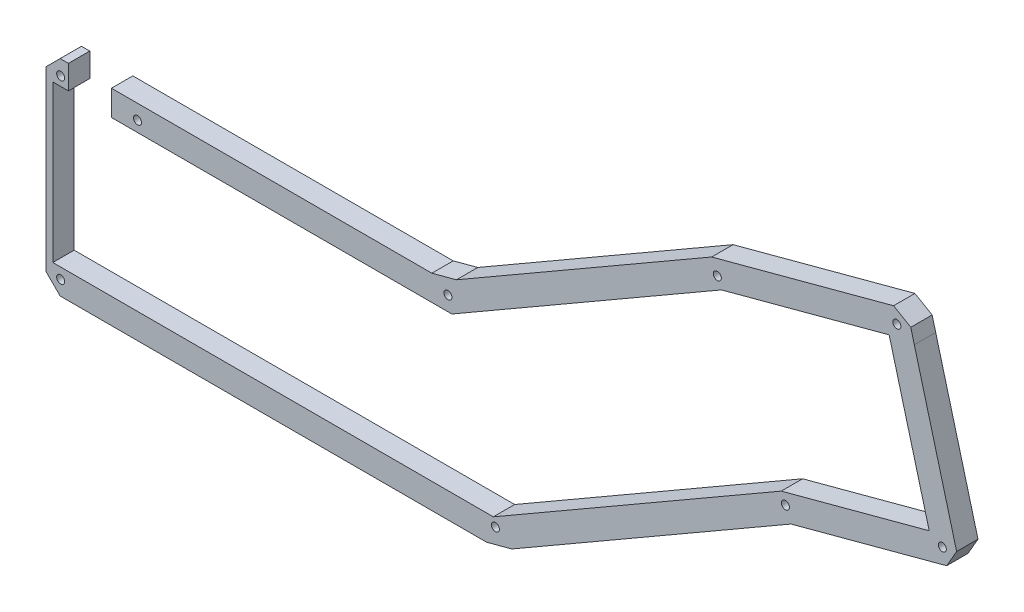
from build123d import *

# Parameters (mm, degrees)
ESQUISSE1_R        = 1.5
BOSS_EXTRU_1_DEPTH = 8


with BuildPart() as part:
    # Esquisse1 → Boss.-Extru.1 (new body)
    with BuildSketch(Plane.XY):
        Polygon((43.238760989, 49.585106383), (-75.988646329, 49.585106383), (-76.753762562, 49.585106383), (-76.753762562, 40.085106383), (2.011353671, 40.085106383), (50.71612997, 40.085106383), (151.689760112, 98.382258927), (214.4831558, 115.207698591), (229.494660416, 59.184000666), (174.076924484, 44.334863077), (66.257183131, -17.914893617), (-98.698564415, -17.914893617), (-98.698564415, 40.655573641), (-94.860830925, 40.655573641), (-92.861789188, 40.655573641), (-92.861789188, 49.585106383), (-94.860830925, 49.585106383), (-95.960869343, 49.585106383), (-101.253762562, 44.292213164), (-101.253762562, 35.79522772), (-101.253762562, -22.122000398), (-95.960869343, -27.414893617), (63.734552111, -27.414893617), (73.191845678, -24.880819443), (177.743787613, 35.482272378), (236.017194438, 51.096584676), (239.759835125, 57.579028501), (228.577013006, 99.31388882), (223.918643626, 116.699160027), (222.600104344, 121.736116557), (216.144691957, 125.488029577), (211.058449045, 124.125174896), (148.022896982, 107.234849626), (52.44172146, 52.051032209), align=None)
        with Locations((-95.753762562, -21.914893617)):
            Circle(ESQUISSE1_R, mode=Mode.SUBTRACT)
        with Locations((67.039694146, -20.835264486)):
            Circle(ESQUISSE1_R, mode=Mode.SUBTRACT)
        with Locations((-95.753762562, 44.085106383)):
            Circle(ESQUISSE1_R, mode=Mode.SUBTRACT)
        with Locations((-66.988646329, 44.085106383)):
            Circle(ESQUISSE1_R, mode=Mode.SUBTRACT)
        with Locations((49.263745973, 45.505477252)):
            Circle(ESQUISSE1_R, mode=Mode.SUBTRACT)
        with Locations((175.637377655, 40.567595866)):
            Circle(ESQUISSE1_R, mode=Mode.SUBTRACT)
        with Locations((234.393639901, 56.355573542)):
            Circle(ESQUISSE1_R, mode=Mode.SUBTRACT)
        with Locations((150.12930694, 102.149526137)):
            Circle(ESQUISSE1_R, mode=Mode.SUBTRACT)
        with Locations((217.363403759, 120.120565138)):
            Circle(ESQUISSE1_R, mode=Mode.SUBTRACT)
    extrude(amount=BOSS_EXTRU_1_DEPTH)


solid = part.part
